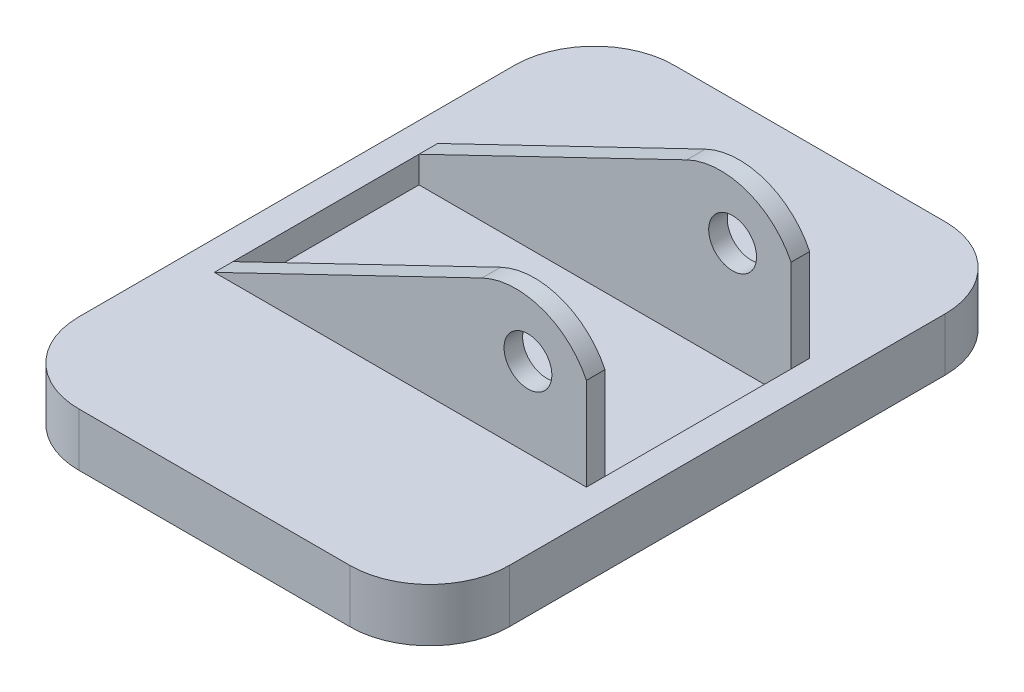
from build123d import *

# Parameters (mm, degrees)
EXTRUDE_1_DEPTH     = 10
SKETCH_2_W          = 70
SKETCH_2_H          = 42
EXTRUDE_2_DEPTH     = 27
SKETCH_3_W          = 70
SKETCH_3_H          = 35
CUT_EXTRUDE_1_DEPTH = 32
SKETCH_4_R          = 4.5
CUT_EXTRUDE_2_DEPTH = 118.724254086


with BuildPart() as part:
    # Sketch 150 → 凸台-拉伸1 (new body)
    with BuildSketch(Plane(origin=(0, 0, 0), x_dir=(1, 0, 0), z_dir=(0, 1, 0))):
        with BuildLine():
            Line((15, 0), (66, 0))
            ThreePointArc((66, 0), (76.606601718, 4.393398282), (81, 15))
            Line((81, 15), (81, 97))
            ThreePointArc((81, 97), (76.606601718, 107.606601718), (66, 112))
            Line((66, 112), (15, 112))
            ThreePointArc((15, 112), (4.393398282, 107.606601718), (0, 97))
            Line((0, 97), (0, 15))
            ThreePointArc((0, 15), (4.393398282, 4.393398282), (15, 0))
        make_face()
    extrude(amount=EXTRUDE_1_DEPTH)

    # 草图2 → 凸台-拉伸2 (add)
    with BuildSketch(Plane(origin=(0, 10, 0), x_dir=(1, 0, 0), z_dir=(0, 1, 0))):
        with Locations((40.5, 56)):
            Rectangle(SKETCH_2_W, SKETCH_2_H)
    extrude(amount=EXTRUDE_2_DEPTH)

    # 草图3 → 切除-拉伸1 (cut)
    with BuildSketch(Plane(origin=(0, 37, 0), x_dir=(1, 0, 0), z_dir=(0, 1, 0))):
        with Locations((40.5, 56)):
            Rectangle(SKETCH_3_W, SKETCH_3_H)
    extrude(amount=-CUT_EXTRUDE_1_DEPTH, mode=Mode.SUBTRACT)

    # 草图4 → 切除-拉伸2 (cut, through all)
    with BuildSketch(Plane.XY.offset(-35)):
        with Locations((64.5, 25)):
            Circle(SKETCH_4_R)
        with BuildLine():
            Line((5.5, 10), (2.465175939, 10))
            Line((2.465175939, 10), (2.465175939, 42.34627873))
            Line((2.465175939, 42.34627873), (79.036091511, 42.34627873))
            Line((79.036091511, 42.34627873), (79.036091511, 27.396377445))
            Line((79.036091511, 27.396377445), (75.5, 27.396377445))
            ThreePointArc((75.5, 27.396377445), (67.105558918, 34.896122118), (55.866672389, 34.26347622))
            Line((55.866672389, 34.26347622), (5.5, 10))
        make_face()
    extrude(amount=-CUT_EXTRUDE_2_DEPTH, mode=Mode.SUBTRACT)


solid = part.part
